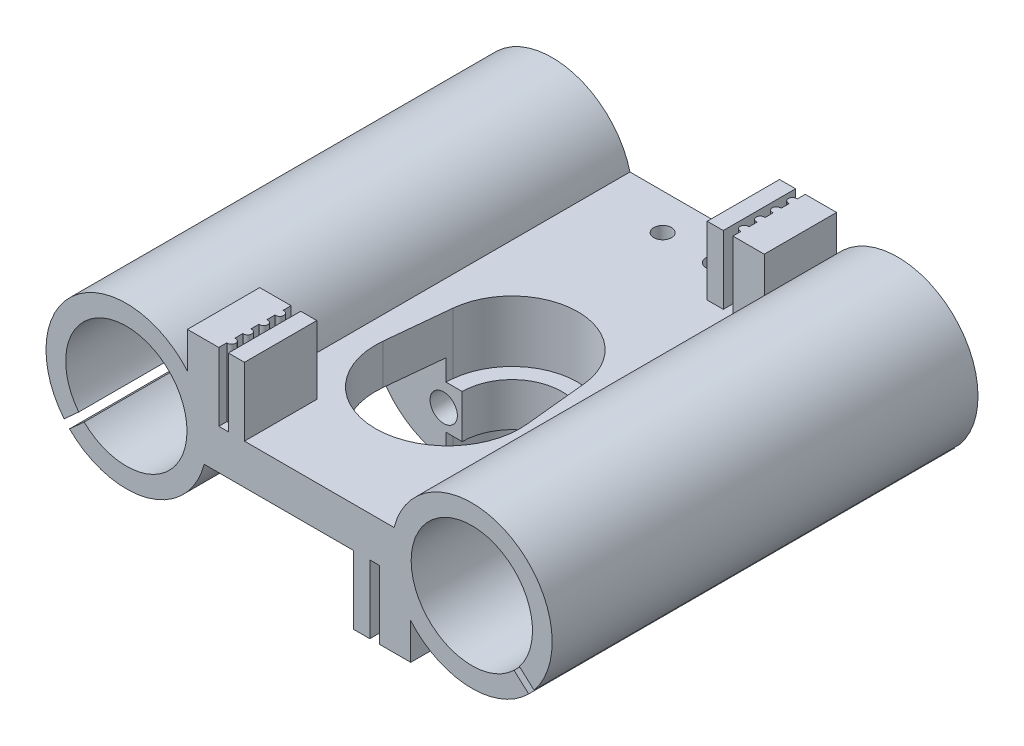
from build123d import *

# Parameters (mm, degrees)
BOSS_EXTRUDE1_DEPTH = 26.5
SKETCH2_R           = 7.55
CUT_EXTRUDE1_DEPTH  = 63.459987192
CUT_EXTRUDE2_DEPTH  = 63.459987192
SKETCH4_R           = 1.1
CUT_EXTRUDE3_DEPTH  = 44.020344025
SKETCH5_W           = 2
SKETCH5_H           = 9
SKETCH5_W_2         = 3.9
BOSS_EXTRUDE2_DEPTH = 8.5
BOSS_EXTRUDE3_REACH = 48.211
BOSS_EXTRUDE4_START = -26.5
BOSS_EXTRUDE4_DEPTH = 9.5
CUT_EXTRUDE4_DEPTH  = 45.164465354
BOSS_EXTRUDE5_START = -7.6
BOSS_EXTRUDE5_DEPTH = 5.4
SKETCH10_R          = 1.7
CUT_EXTRUDE5_DEPTH  = 50.704124605
SKETCH11_R          = 3
CUT_EXTRUDE6_DEPTH  = 3
SKETCH12_W          = 2
SKETCH12_H          = 9
SKETCH12_W_2        = 3.9
BOSS_EXTRUDE6_DEPTH = 8.5
BOSS_EXTRUDE7_REACH = 48.674


with BuildPart() as part:
    # Sketch1 → Boss-Extrude1 (new, symmetric)
    with BuildSketch(Plane.XY):
        with BuildLine():
            Line((-11.817541634, 2.5), (11.817541634, 2.5))
            ThreePointArc((11.817541634, 2.5), (31.5, 0), (11.817541634, -2.5))
            Line((11.817541634, -2.5), (-11.817541634, -2.5))
            ThreePointArc((-11.817541634, -2.5), (-31.5, 0), (-11.817541634, 2.5))
        make_face()
    extrude(amount=BOSS_EXTRUDE1_DEPTH, both=True)

    # Sketch2 → Cut-Extrude1 (cut, through all)
    with BuildSketch(Plane.XY.offset(26.5)):
        with Locations((-21.5, 0)):
            Circle(SKETCH2_R)
        with Locations((21.5, 0)):
            Circle(SKETCH2_R)
    extrude(amount=-CUT_EXTRUDE1_DEPTH, mode=Mode.SUBTRACT)

    # Sketch3 → Cut-Extrude2 (cut, through all)
    with BuildSketch(Plane.XY.offset(26.5)):
        with BuildLine():
            Line((-27.424833042, -4.679621077), (-29.245691217, -6.324892692))
            ThreePointArc((-29.245691217, -6.324892692), (-28.91975841, -6.70426619), (-28.575264598, -7.066868533))
            Line((-28.575264598, -7.066868533), (-26.754406423, -5.421596918))
            ThreePointArc((-26.754406423, -5.421596918), (-27.101917599, -5.061720973), (-27.424833042, -4.679621077))
        make_face()
        with BuildLine():
            Line((26.754406423, -5.421596918), (28.575264598, -7.066868533))
            ThreePointArc((28.575264598, -7.066868533), (28.91975841, -6.70426619), (29.245691217, -6.324892692))
            Line((29.245691217, -6.324892692), (27.424833042, -4.679621077))
            ThreePointArc((27.424833042, -4.679621077), (27.101917599, -5.061720973), (26.754406423, -5.421596918))
        make_face()
    extrude(amount=-CUT_EXTRUDE2_DEPTH, mode=Mode.SUBTRACT)

    # Sketch4 → Cut-Extrude3 (cut, through all)
    with BuildSketch(Plane(origin=(0, 2.5, 0), x_dir=(1, 0, 0), z_dir=(0, 1, 0))):
        with Locations(Location((-3.25, 22, 0), (0, 0, 270))):
            Circle(SKETCH4_R)
        with Locations(Location((3.25, 22, 0), (0, 0, 270))):
            Circle(SKETCH4_R)
        with BuildLine():
            Line((-8.158896984, 0.82), (-8.954886934, -7.1))
            ThreePointArc((-8.954886934, -7.1), (0, -17), (8.954886934, -7.1))
            Line((8.954886934, -7.1), (8.158896984, 0.82))
            ThreePointArc((8.158896984, 0.82), (0, 8.2), (-8.158896984, 0.82))
        make_face()
    extrude(amount=-CUT_EXTRUDE3_DEPTH, mode=Mode.SUBTRACT)

    # Sketch5 → Boss-Extrude2 (add)
    with BuildSketch(Plane(origin=(0, 2.5, 0), x_dir=(1, 0, 0), z_dir=(0, 1, 0))):
        with Locations((-7.796681634, -22)):
            Rectangle(SKETCH5_W, SKETCH5_H)
        with Locations((-11.946681634, -22)):
            Rectangle(SKETCH5_W_2, SKETCH5_H)
        with Locations((7.796681634, 22)):
            Rectangle(SKETCH5_W, SKETCH5_H)
        with Locations((11.946681634, 22)):
            Rectangle(SKETCH5_W_2, SKETCH5_H)
    extrude(amount=BOSS_EXTRUDE2_DEPTH)

    # Sketch6 → Boss-Extrude3 (add, up to next)
    with BuildSketch(Plane(origin=(0, 11, 0), x_dir=(1, 0, 0), z_dir=(0, 1, 0)), mode=Mode.PRIVATE) as boss_extrude3_sk1:
        with BuildLine():
            Line((-9.896681634, -24.5), (-9.996681634, -24.5))
            Line((-9.996681634, -24.5), (-9.996681634, -25.5))
            Line((-9.996681634, -25.5), (-9.896681634, -25.5))
            ThreePointArc((-9.896681634, -25.5), (-9.396681634, -25), (-9.896681634, -24.5))
        make_face()
    boss_extrude3_tool1 = extrude(boss_extrude3_sk1.sketch, amount=-BOSS_EXTRUDE3_REACH, mode=Mode.PRIVATE) - part.part
    # Sketch6 → Boss-Extrude3 (add, up to next)
    with BuildSketch(Plane(origin=(0, 11, 0), x_dir=(1, 0, 0), z_dir=(0, 1, 0)), mode=Mode.PRIVATE) as boss_extrude3_sk2:
        with BuildLine():
            Line((-9.896681634, -22.5), (-9.996681634, -22.5))
            Line((-9.996681634, -22.5), (-9.996681634, -23.5))
            Line((-9.996681634, -23.5), (-9.896681634, -23.5))
            ThreePointArc((-9.896681634, -23.5), (-9.396681634, -23), (-9.896681634, -22.5))
        make_face()
    boss_extrude3_tool2 = extrude(boss_extrude3_sk2.sketch, amount=-BOSS_EXTRUDE3_REACH, mode=Mode.PRIVATE) - part.part
    # Sketch6 → Boss-Extrude3 (add, up to next)
    with BuildSketch(Plane(origin=(0, 11, 0), x_dir=(1, 0, 0), z_dir=(0, 1, 0)), mode=Mode.PRIVATE) as boss_extrude3_sk3:
        with BuildLine():
            Line((-9.896681634, -20.5), (-9.996681634, -20.5))
            Line((-9.996681634, -20.5), (-9.996681634, -21.5))
            Line((-9.996681634, -21.5), (-9.896681634, -21.5))
            ThreePointArc((-9.896681634, -21.5), (-9.396681634, -21), (-9.896681634, -20.5))
        make_face()
    boss_extrude3_tool3 = extrude(boss_extrude3_sk3.sketch, amount=-BOSS_EXTRUDE3_REACH, mode=Mode.PRIVATE) - part.part
    # Sketch6 → Boss-Extrude3 (add, up to next)
    with BuildSketch(Plane(origin=(0, 11, 0), x_dir=(1, 0, 0), z_dir=(0, 1, 0)), mode=Mode.PRIVATE) as boss_extrude3_sk4:
        with BuildLine():
            Line((-9.896681634, -18.5), (-9.996681634, -18.5))
            Line((-9.996681634, -18.5), (-9.996681634, -19.5))
            Line((-9.996681634, -19.5), (-9.896681634, -19.5))
            ThreePointArc((-9.896681634, -19.5), (-9.396681634, -19), (-9.896681634, -18.5))
        make_face()
    boss_extrude3_tool4 = extrude(boss_extrude3_sk4.sketch, amount=-BOSS_EXTRUDE3_REACH, mode=Mode.PRIVATE) - part.part
    # Sketch6 → Boss-Extrude3 (add, up to next)
    with BuildSketch(Plane(origin=(0, 11, 0), x_dir=(1, 0, 0), z_dir=(0, 1, 0)), mode=Mode.PRIVATE) as boss_extrude3_sk5:
        with BuildLine():
            Line((9.996681634, 25.5), (9.996681634, 24.5))
            Line((9.996681634, 24.5), (9.896681634, 24.5))
            ThreePointArc((9.896681634, 24.5), (9.396681634, 25), (9.896681634, 25.5))
            Line((9.896681634, 25.5), (9.996681634, 25.5))
        make_face()
    boss_extrude3_tool5 = extrude(boss_extrude3_sk5.sketch, amount=-BOSS_EXTRUDE3_REACH, mode=Mode.PRIVATE) - part.part
    # Sketch6 → Boss-Extrude3 (add, up to next)
    with BuildSketch(Plane(origin=(0, 11, 0), x_dir=(1, 0, 0), z_dir=(0, 1, 0)), mode=Mode.PRIVATE) as boss_extrude3_sk6:
        with BuildLine():
            Line((9.996681634, 23.5), (9.996681634, 22.5))
            Line((9.996681634, 22.5), (9.896681634, 22.5))
            ThreePointArc((9.896681634, 22.5), (9.396681634, 23), (9.896681634, 23.5))
            Line((9.896681634, 23.5), (9.996681634, 23.5))
        make_face()
    boss_extrude3_tool6 = extrude(boss_extrude3_sk6.sketch, amount=-BOSS_EXTRUDE3_REACH, mode=Mode.PRIVATE) - part.part
    # Sketch6 → Boss-Extrude3 (add, up to next)
    with BuildSketch(Plane(origin=(0, 11, 0), x_dir=(1, 0, 0), z_dir=(0, 1, 0)), mode=Mode.PRIVATE) as boss_extrude3_sk7:
        with BuildLine():
            Line((9.996681634, 21.5), (9.996681634, 20.5))
            Line((9.996681634, 20.5), (9.896681634, 20.5))
            ThreePointArc((9.896681634, 20.5), (9.396681634, 21), (9.896681634, 21.5))
            Line((9.896681634, 21.5), (9.996681634, 21.5))
        make_face()
    boss_extrude3_tool7 = extrude(boss_extrude3_sk7.sketch, amount=-BOSS_EXTRUDE3_REACH, mode=Mode.PRIVATE) - part.part
    # Sketch6 → Boss-Extrude3 (add, up to next)
    with BuildSketch(Plane(origin=(0, 11, 0), x_dir=(1, 0, 0), z_dir=(0, 1, 0)), mode=Mode.PRIVATE) as boss_extrude3_sk8:
        with BuildLine():
            Line((9.996681634, 19.5), (9.996681634, 18.5))
            Line((9.996681634, 18.5), (9.896681634, 18.5))
            ThreePointArc((9.896681634, 18.5), (9.396681634, 19), (9.896681634, 19.5))
            Line((9.896681634, 19.5), (9.996681634, 19.5))
        make_face()
    boss_extrude3_tool8 = extrude(boss_extrude3_sk8.sketch, amount=-BOSS_EXTRUDE3_REACH, mode=Mode.PRIVATE) - part.part
    add(boss_extrude3_tool1.solids().sort_by_distance((-9.737693, 11, 25))[0])
    add(boss_extrude3_tool2.solids().sort_by_distance((-9.737693, 11, 23))[0])
    add(boss_extrude3_tool3.solids().sort_by_distance((-9.737693, 11, 21))[0])
    add(boss_extrude3_tool4.solids().sort_by_distance((-9.737693, 11, 19))[0])
    add(boss_extrude3_tool5.solids().sort_by_distance((9.737693, 11, -25))[0])
    add(boss_extrude3_tool6.solids().sort_by_distance((9.737693, 11, -23))[0])
    add(boss_extrude3_tool7.solids().sort_by_distance((9.737693, 11, -21))[0])
    add(boss_extrude3_tool8.solids().sort_by_distance((9.737693, 11, -19))[0])

    # Sketch7 → Boss-Extrude4 (add)
    with BuildSketch(Plane.XY.offset(26.5).offset(BOSS_EXTRUDE4_START)):
        with BuildLine():
            Line((-7.5, -13.5), (7.5, -13.5))
            ThreePointArc((7.5, -13.5), (12.516489259, -12.150713006), (16.179241776, -8.466967103))
            ThreePointArc((16.179241776, -8.466967103), (13.426877858, -5.901245537), (11.817541634, -2.5))
            Line((11.817541634, -2.5), (-11.817541634, -2.5))
            ThreePointArc((-11.817541634, -2.5), (-13.426877858, -5.901245537), (-16.179241776, -8.466967103))
            ThreePointArc((-16.179241776, -8.466967103), (-12.516489259, -12.150713006), (-7.5, -13.5))
        make_face()
    extrude(amount=-BOSS_EXTRUDE4_DEPTH)

    # Sketch8 → Cut-Extrude4 (cut, through all)
    with BuildSketch(Plane(origin=(0, 2.5, 0), x_dir=(1, 0, 0), z_dir=(0, 1, 0))):
        with BuildLine():
            Line((-8.158896984, 0.82), (-8.241310085, 0))
            Line((-8.241310085, 0), (8.241310085, 0))
            Line((8.241310085, 0), (8.158896984, 0.82))
            ThreePointArc((8.158896984, 0.82), (0, 8.2), (-8.158896984, 0.82))
        make_face()
    extrude(amount=-CUT_EXTRUDE4_DEPTH, mode=Mode.SUBTRACT)

    # Sketch9 → Boss-Extrude5 (add)
    with BuildSketch(Plane(origin=(0, 2.5, 0), x_dir=(1, 0, 0), z_dir=(0, 1, 0)).offset(BOSS_EXTRUDE5_START)):
        with BuildLine():
            Line((-6.2, 0), (-8.241310085, 0))
            Line((-8.241310085, 0), (-8.158896984, 0.82))
            ThreePointArc((-8.158896984, 0.82), (0, 8.2), (8.158896984, 0.82))
            Line((8.158896984, 0.82), (8.241310085, 0))
            Line((8.241310085, 0), (6.2, 0))
            ThreePointArc((6.2, 0), (0, 6.2), (-6.2, 0))
        make_face()
    extrude(amount=-BOSS_EXTRUDE5_DEPTH)

    # Sketch10 → Cut-Extrude5 (cut, through all)
    with BuildSketch(Plane(origin=(0, 0, -9.5), x_dir=(-1, 0, 0), z_dir=(0, 0, -1))):
        with Locations((-8.5, -8)):
            Circle(SKETCH10_R)
        with Locations((8.5, -8)):
            Circle(SKETCH10_R)
    extrude(amount=-CUT_EXTRUDE5_DEPTH, mode=Mode.SUBTRACT)

    # Sketch11 → Cut-Extrude6 (cut)
    with BuildSketch(Plane(origin=(0, 0, -9.5), x_dir=(-1, 0, 0), z_dir=(0, 0, -1))):
        with Locations((-8.5, -8)):
            Circle(SKETCH11_R)
        Polygon((6.887285, -10.793304318), (10.112715, -10.793304318), (11.72543, -8), (10.112715, -5.206695682), (6.887285, -5.206695682), (5.27457, -8), align=None)
    extrude(amount=-CUT_EXTRUDE6_DEPTH, mode=Mode.SUBTRACT)

    # Sketch12 → Boss-Extrude6 (add)
    with BuildSketch(Plane.XZ.offset(2.5)):
        with Locations((-7.796681634, -22)):
            Rectangle(SKETCH12_W, SKETCH12_H)
        with Locations((-11.946681634, -22)):
            Rectangle(SKETCH12_W_2, SKETCH12_H)
        with Locations((7.796681634, 22)):
            Rectangle(SKETCH12_W, SKETCH12_H)
        with Locations((11.946681634, 22)):
            Rectangle(SKETCH12_W_2, SKETCH12_H)
    extrude(amount=BOSS_EXTRUDE6_DEPTH)

    # Sketch13 → Boss-Extrude7 (add, up to next)
    with BuildSketch(Plane.XZ.offset(11), mode=Mode.PRIVATE) as boss_extrude7_sk1:
        with BuildLine():
            Line((-9.896681634, -24.5), (-9.996681634, -24.5))
            Line((-9.996681634, -24.5), (-9.996681634, -25.5))
            Line((-9.996681634, -25.5), (-9.896681634, -25.5))
            ThreePointArc((-9.896681634, -25.5), (-9.396681634, -25), (-9.896681634, -24.5))
        make_face()
    boss_extrude7_tool1 = extrude(boss_extrude7_sk1.sketch, amount=-BOSS_EXTRUDE7_REACH, mode=Mode.PRIVATE) - part.part
    # Sketch13 → Boss-Extrude7 (add, up to next)
    with BuildSketch(Plane.XZ.offset(11), mode=Mode.PRIVATE) as boss_extrude7_sk2:
        with BuildLine():
            Line((-9.896681634, -22.5), (-9.996681634, -22.5))
            Line((-9.996681634, -22.5), (-9.996681634, -23.5))
            Line((-9.996681634, -23.5), (-9.896681634, -23.5))
            ThreePointArc((-9.896681634, -23.5), (-9.396681634, -23), (-9.896681634, -22.5))
        make_face()
    boss_extrude7_tool2 = extrude(boss_extrude7_sk2.sketch, amount=-BOSS_EXTRUDE7_REACH, mode=Mode.PRIVATE) - part.part
    # Sketch13 → Boss-Extrude7 (add, up to next)
    with BuildSketch(Plane.XZ.offset(11), mode=Mode.PRIVATE) as boss_extrude7_sk3:
        with BuildLine():
            Line((-9.896681634, -20.5), (-9.996681634, -20.5))
            Line((-9.996681634, -20.5), (-9.996681634, -21.5))
            Line((-9.996681634, -21.5), (-9.896681634, -21.5))
            ThreePointArc((-9.896681634, -21.5), (-9.396681634, -21), (-9.896681634, -20.5))
        make_face()
    boss_extrude7_tool3 = extrude(boss_extrude7_sk3.sketch, amount=-BOSS_EXTRUDE7_REACH, mode=Mode.PRIVATE) - part.part
    # Sketch13 → Boss-Extrude7 (add, up to next)
    with BuildSketch(Plane.XZ.offset(11), mode=Mode.PRIVATE) as boss_extrude7_sk4:
        with BuildLine():
            Line((-9.896681634, -18.5), (-9.996681634, -18.5))
            Line((-9.996681634, -18.5), (-9.996681634, -19.5))
            Line((-9.996681634, -19.5), (-9.896681634, -19.5))
            ThreePointArc((-9.896681634, -19.5), (-9.396681634, -19), (-9.896681634, -18.5))
        make_face()
    boss_extrude7_tool4 = extrude(boss_extrude7_sk4.sketch, amount=-BOSS_EXTRUDE7_REACH, mode=Mode.PRIVATE) - part.part
    # Sketch13 → Boss-Extrude7 (add, up to next)
    with BuildSketch(Plane.XZ.offset(11), mode=Mode.PRIVATE) as boss_extrude7_sk5:
        with BuildLine():
            Line((9.896681634, 25.5), (9.996681634, 25.5))
            Line((9.996681634, 25.5), (9.996681634, 24.5))
            Line((9.996681634, 24.5), (9.896681634, 24.5))
            ThreePointArc((9.896681634, 24.5), (9.396681634, 25), (9.896681634, 25.5))
        make_face()
    boss_extrude7_tool5 = extrude(boss_extrude7_sk5.sketch, amount=-BOSS_EXTRUDE7_REACH, mode=Mode.PRIVATE) - part.part
    # Sketch13 → Boss-Extrude7 (add, up to next)
    with BuildSketch(Plane.XZ.offset(11), mode=Mode.PRIVATE) as boss_extrude7_sk6:
        with BuildLine():
            Line((9.896681634, 23.5), (9.996681634, 23.5))
            Line((9.996681634, 23.5), (9.996681634, 22.5))
            Line((9.996681634, 22.5), (9.896681634, 22.5))
            ThreePointArc((9.896681634, 22.5), (9.396681634, 23), (9.896681634, 23.5))
        make_face()
    boss_extrude7_tool6 = extrude(boss_extrude7_sk6.sketch, amount=-BOSS_EXTRUDE7_REACH, mode=Mode.PRIVATE) - part.part
    # Sketch13 → Boss-Extrude7 (add, up to next)
    with BuildSketch(Plane.XZ.offset(11), mode=Mode.PRIVATE) as boss_extrude7_sk7:
        with BuildLine():
            Line((9.896681634, 21.5), (9.996681634, 21.5))
            Line((9.996681634, 21.5), (9.996681634, 20.5))
            Line((9.996681634, 20.5), (9.896681634, 20.5))
            ThreePointArc((9.896681634, 20.5), (9.396681634, 21), (9.896681634, 21.5))
        make_face()
    boss_extrude7_tool7 = extrude(boss_extrude7_sk7.sketch, amount=-BOSS_EXTRUDE7_REACH, mode=Mode.PRIVATE) - part.part
    # Sketch13 → Boss-Extrude7 (add, up to next)
    with BuildSketch(Plane.XZ.offset(11), mode=Mode.PRIVATE) as boss_extrude7_sk8:
        with BuildLine():
            Line((9.896681634, 19.5), (9.996681634, 19.5))
            Line((9.996681634, 19.5), (9.996681634, 18.5))
            Line((9.996681634, 18.5), (9.896681634, 18.5))
            ThreePointArc((9.896681634, 18.5), (9.396681634, 19), (9.896681634, 19.5))
        make_face()
    boss_extrude7_tool8 = extrude(boss_extrude7_sk8.sketch, amount=-BOSS_EXTRUDE7_REACH, mode=Mode.PRIVATE) - part.part
    add(boss_extrude7_tool1.solids().sort_by_distance((-9.737693, -11, -25))[0])
    add(boss_extrude7_tool2.solids().sort_by_distance((-9.737693, -11, -23))[0])
    add(boss_extrude7_tool3.solids().sort_by_distance((-9.737693, -11, -21))[0])
    add(boss_extrude7_tool4.solids().sort_by_distance((-9.737693, -11, -19))[0])
    add(boss_extrude7_tool5.solids().sort_by_distance((9.737693, -11, 25))[0])
    add(boss_extrude7_tool6.solids().sort_by_distance((9.737693, -11, 23))[0])
    add(boss_extrude7_tool7.solids().sort_by_distance((9.737693, -11, 21))[0])
    add(boss_extrude7_tool8.solids().sort_by_distance((9.737693, -11, 19))[0])


solid = part.part
